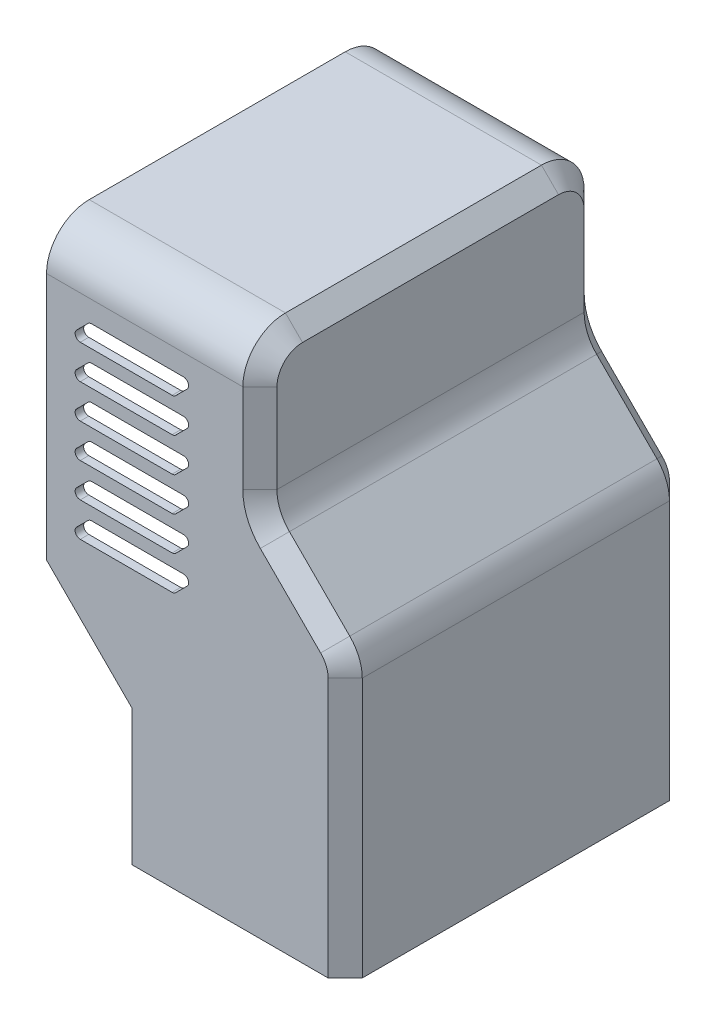
from build123d import *

# Parameters (mm, degrees)
BOSS_EXTRUDE1_DEPTH = 50.8
FILLET2_R           = 12.7
CHAMFER1_SIZE       = 5.08
SHELL1_T            = -2.54
CUT_EXTRUDE1_DEPTH  = 204.596488182


with BuildPart() as part:
    # Sketch1 → Boss-Extrude1 (new, symmetric)
    with BuildSketch(Plane.XY):
        Polygon((0, 0), (0, 82.55), (-25.4, 107.95), (-25.4, 152.4), (-88.9, 152.4), (-88.9, 65.828865162), (-63.5, 40.428865162), (-63.5, 0), align=None)
    extrude(amount=BOSS_EXTRUDE1_DEPTH, both=True)

    # Fillet2
    fillet2_edges = [part.edges().sort_by_distance(p)[0] for p in [
        (-25.4, 107.95, 0),
        (0, 82.55, 0),
        (-57.15, 152.4, 50.8),
        (-57.15, 152.4, -50.8),
    ]]
    fillet(fillet2_edges, radius=FILLET2_R)

    # Chamfer1
    chamfer1_edges = [part.edges().sort_by_distance(p)[0] for p in [
        (0, 38.644743879, -50.8),
        (-12.7, 95.25, -50.8),
        (-12.7, 95.25, 50.8),
        (-25.4, 126.455256121, -50.8),
        (-0.966729937, 82.149567349, -50.8),
        (-25.4, 126.455256121, 50.8),
        (-0.966729937, 82.149567349, 50.8),
        (-25.4, 152.4, 0),
        (-25.4, 148.680256121, 47.080256121),
        (-25.4, 148.680256121, -47.080256121),
        (-24.433270063, 108.350432651, -50.8),
        (-24.433270063, 108.350432651, 50.8),
        (0, 38.644743879, 50.8),
    ]]
    chamfer(chamfer1_edges, length=CHAMFER1_SIZE)

    # Shell1
    shell1_openings = [part.faces().sort_by_distance(p)[0] for p in [
        (-63.5, 20.214432581, 0),
        (-76.2, 53.128865162, 0),
        (-88.9, 108.793553587, 0),
        (-31.870709505, 0, 0),
    ]]
    offset(amount=SHELL1_T, openings=shell1_openings, kind=Kind.INTERSECTION)

    # Sketch2 → Cut-Extrude1 (cut, through all)
    with BuildSketch(Plane.XY.offset(50.8)):
        with BuildLine():
            Line((-75.481467356, 133.437271175), (-48.129261469, 133.437271175))
            ThreePointArc((-48.129261469, 133.437271175), (-46.721269062, 132.496480726), (-47.051630735, 130.835640441))
            Line((-47.051630735, 130.835640441), (-50.44090191, 127.446369265))
            ThreePointArc((-50.44090191, 127.446369265), (-50.935323093, 127.116007592), (-51.518532644, 127))
            Line((-51.518532644, 127), (-78.870738531, 127))
            ThreePointArc((-78.870738531, 127), (-80.278730938, 127.940790449), (-79.948369265, 129.601630735))
            Line((-79.948369265, 129.601630735), (-76.55909809, 132.99090191))
            ThreePointArc((-76.55909809, 132.99090191), (-76.064676907, 133.321263583), (-75.481467356, 133.437271175))
        make_face()
        with BuildLine():
            Line((-75.481467356, 123.277271175), (-48.129261469, 123.277271175))
            ThreePointArc((-48.129261469, 123.277271175), (-46.721269062, 122.336480726), (-47.051630735, 120.675640441))
            Line((-47.051630735, 120.675640441), (-50.44090191, 117.286369265))
            ThreePointArc((-50.44090191, 117.286369265), (-50.935323093, 116.956007592), (-51.518532644, 116.84))
            Line((-51.518532644, 116.84), (-78.870738531, 116.84))
            ThreePointArc((-78.870738531, 116.84), (-80.278730938, 117.780790449), (-79.948369265, 119.441630735))
            Line((-79.948369265, 119.441630735), (-76.55909809, 122.83090191))
            ThreePointArc((-76.55909809, 122.83090191), (-76.064676907, 123.161263583), (-75.481467356, 123.277271175))
        make_face()
        with BuildLine():
            Line((-75.481467356, 113.117271175), (-48.129261469, 113.117271175))
            ThreePointArc((-48.129261469, 113.117271175), (-46.721269062, 112.176480726), (-47.051630735, 110.515640441))
            Line((-47.051630735, 110.515640441), (-50.44090191, 107.126369265))
            ThreePointArc((-50.44090191, 107.126369265), (-50.935323093, 106.796007592), (-51.518532644, 106.68))
            Line((-51.518532644, 106.68), (-78.870738531, 106.68))
            ThreePointArc((-78.870738531, 106.68), (-80.278730938, 107.620790449), (-79.948369265, 109.281630735))
            Line((-79.948369265, 109.281630735), (-76.55909809, 112.67090191))
            ThreePointArc((-76.55909809, 112.67090191), (-76.064676907, 113.001263583), (-75.481467356, 113.117271175))
        make_face()
        with BuildLine():
            Line((-75.481467356, 102.957271175), (-48.129261469, 102.957271175))
            ThreePointArc((-48.129261469, 102.957271175), (-46.721269062, 102.016480726), (-47.051630735, 100.355640441))
            Line((-47.051630735, 100.355640441), (-50.44090191, 96.966369265))
            ThreePointArc((-50.44090191, 96.966369265), (-50.935323093, 96.636007592), (-51.518532644, 96.52))
            Line((-51.518532644, 96.52), (-78.870738531, 96.52))
            ThreePointArc((-78.870738531, 96.52), (-80.278730938, 97.460790449), (-79.948369265, 99.121630735))
            Line((-79.948369265, 99.121630735), (-76.55909809, 102.51090191))
            ThreePointArc((-76.55909809, 102.51090191), (-76.064676907, 102.841263583), (-75.481467356, 102.957271175))
        make_face()
        with BuildLine():
            Line((-75.481467356, 92.797271175), (-48.129261469, 92.797271175))
            ThreePointArc((-48.129261469, 92.797271175), (-46.721269062, 91.856480726), (-47.051630735, 90.195640441))
            Line((-47.051630735, 90.195640441), (-50.44090191, 86.806369265))
            ThreePointArc((-50.44090191, 86.806369265), (-50.935323093, 86.476007592), (-51.518532644, 86.36))
            Line((-51.518532644, 86.36), (-78.870738531, 86.36))
            ThreePointArc((-78.870738531, 86.36), (-80.278730938, 87.300790449), (-79.948369265, 88.961630735))
            Line((-79.948369265, 88.961630735), (-76.55909809, 92.35090191))
            ThreePointArc((-76.55909809, 92.35090191), (-76.064676907, 92.681263583), (-75.481467356, 92.797271175))
        make_face()
        with BuildLine():
            Line((-75.481467356, 82.637271175), (-48.129261469, 82.637271175))
            ThreePointArc((-48.129261469, 82.637271175), (-46.721269062, 81.696480726), (-47.051630735, 80.035640441))
            Line((-47.051630735, 80.035640441), (-50.44090191, 76.646369265))
            ThreePointArc((-50.44090191, 76.646369265), (-50.935323093, 76.316007592), (-51.518532644, 76.2))
            Line((-51.518532644, 76.2), (-78.870738531, 76.2))
            ThreePointArc((-78.870738531, 76.2), (-80.278730938, 77.140790449), (-79.948369265, 78.801630735))
            Line((-79.948369265, 78.801630735), (-76.55909809, 82.19090191))
            ThreePointArc((-76.55909809, 82.19090191), (-76.064676907, 82.521263583), (-75.481467356, 82.637271175))
        make_face()
    extrude(amount=-CUT_EXTRUDE1_DEPTH, mode=Mode.SUBTRACT)


solid = part.part
